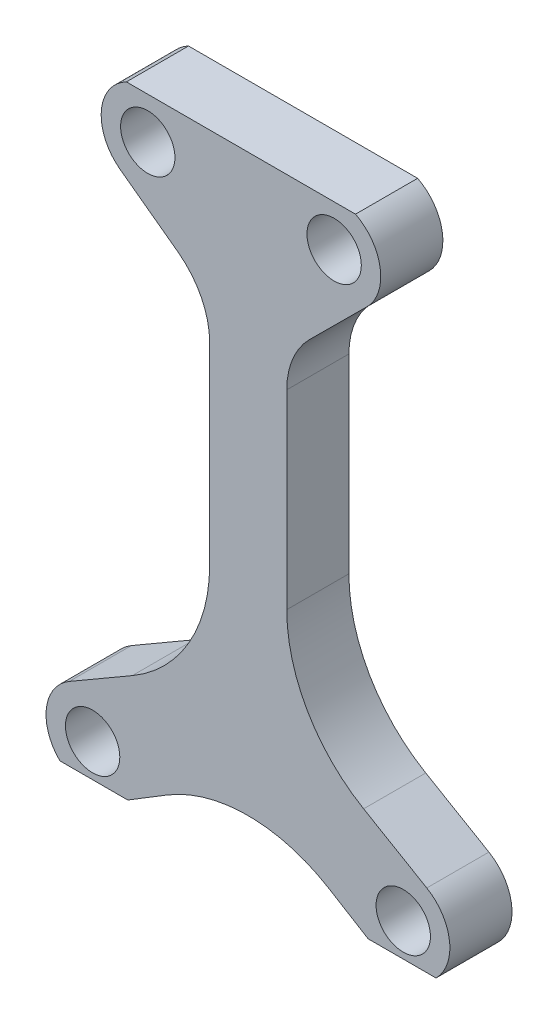
from build123d import *

# Parameters (mm, degrees)
SKETCH_1_W          = 28
SKETCH_1_H          = 40
EXTRUDE_1_DEPTH     = 4
SKETCH_2_R          = 1.75
CUT_EXTRUDE_1_DEPTH = 49.989794856
SKETCH_3_W          = 46.756275812
SKETCH_3_H          = 48.920918211
CUT_EXTRUDE_2_DEPTH = 49.989794856


with BuildPart() as part:
    # 草图1 → 凸台-拉伸1 (new body)
    with BuildSketch(Plane.XY):
        with Locations((14, 20)):
            Rectangle(SKETCH_1_W, SKETCH_1_H)
    extrude(amount=EXTRUDE_1_DEPTH)

    # 草图2 → 切除-拉伸1 (cut, through all)
    with BuildSketch(Plane.XY.offset(4)):
        with Locations((4, 2.134562065)):
            Circle(SKETCH_2_R)
        with Locations((24, 2.134562065)):
            Circle(SKETCH_2_R)
        with Locations((19.55, 37.334562065)):
            Circle(SKETCH_2_R)
        with Locations((7.55, 37.334562065)):
            Circle(SKETCH_2_R)
    extrude(amount=-CUT_EXTRUDE_1_DEPTH, mode=Mode.SUBTRACT)

    # 草图3 → 切除-拉伸2 (cut, through all)
    with BuildSketch(Plane.XY.offset(4)):
        with Locations((16.027589169, 19.550398151)):
            Rectangle(SKETCH_3_W, SKETCH_3_H)
        with BuildLine():
            Line((11.536117859, 28.14529377), (11.536117859, 15.734192521))
            ThreePointArc((11.536117859, 15.734192521), (10.201478432, 10.743047748), (6.553812631, 7.084178696))
            Line((6.553812631, 7.084178696), (2.494691568, 4.729566213))
            ThreePointArc((2.494691568, 4.729566213), (1.422001637, 0.600311616), (5.563000373, -0.426107736))
            Line((5.563000373, -0.426107736), (8.789998756, 1.543611152))
            ThreePointArc((8.789998756, 1.543611152), (14, 3.008045147), (19.210001244, 1.543611152))
            Line((19.210001244, 1.543611152), (22.436999627, -0.426107736))
            ThreePointArc((22.436999627, -0.426107736), (26.575029126, 0.595333362), (25.515325125, 4.72372984))
            Line((25.515325125, 4.72372984), (21.448916251, 7.103618696))
            ThreePointArc((21.448916251, 7.103618696), (17.825011888, 10.759785395), (16.5, 15.734177946))
            Line((16.5, 15.734177946), (16.5, 27.992669275))
            ThreePointArc((16.5, 27.992669275), (16.883437323, 29.912916406), (17.974939618, 31.53864577))
            Line((17.974939618, 31.53864577), (21.665036229, 35.206976168))
            ThreePointArc((21.665036229, 35.206976168), (22.323333526, 38.478511869), (19.55, 40.334562065))
            Line((19.55, 40.334562065), (7.55, 40.334562065))
            ThreePointArc((7.55, 40.334562065), (4.699885996, 38.270964844), (5.77076355, 34.919128842))
            Line((5.77076355, 34.919128842), (9.501511942, 32.171015809))
            ThreePointArc((9.501511942, 32.171015809), (10.998570683, 30.400624077), (11.536117859, 28.14529377))
        make_face(mode=Mode.SUBTRACT)
    extrude(amount=-CUT_EXTRUDE_2_DEPTH, mode=Mode.SUBTRACT)


solid = part.part
